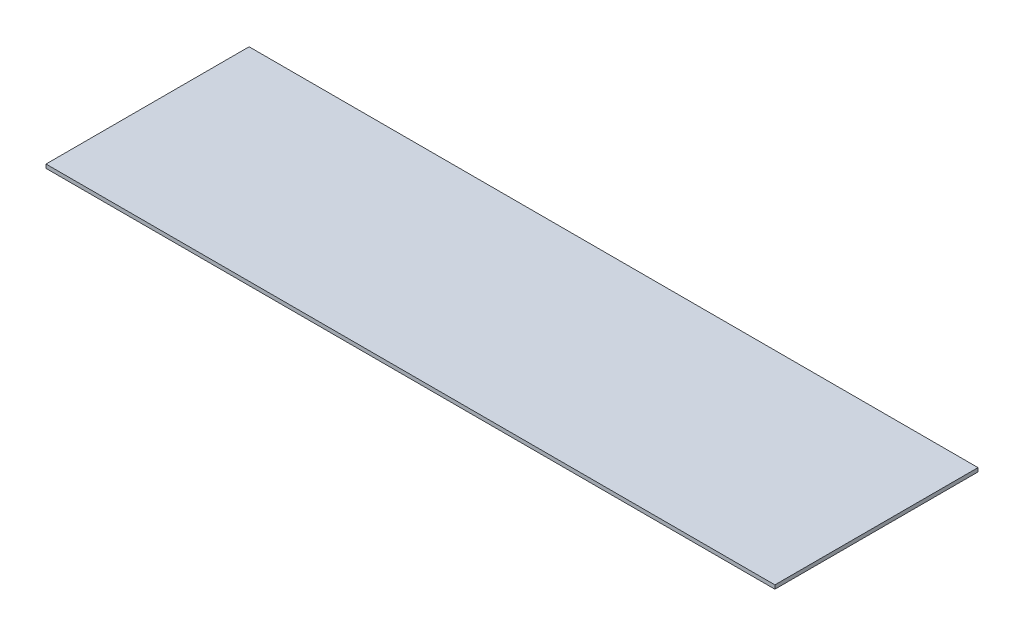
from build123d import *

# Parameters (mm, degrees)
SKETCH1_W           = 2438.4
SKETCH1_H           = 679.45
BOSS_EXTRUDE1_DEPTH = 12.7


with BuildPart() as part:
    # Sketch1 → Boss-Extrude1 (new body)
    with BuildSketch(Plane(origin=(0, 0, 0), x_dir=(1, 0, 0), z_dir=(0, 1, 0))):
        Rectangle(SKETCH1_W, SKETCH1_H)
    extrude(amount=BOSS_EXTRUDE1_DEPTH)


solid = part.part
